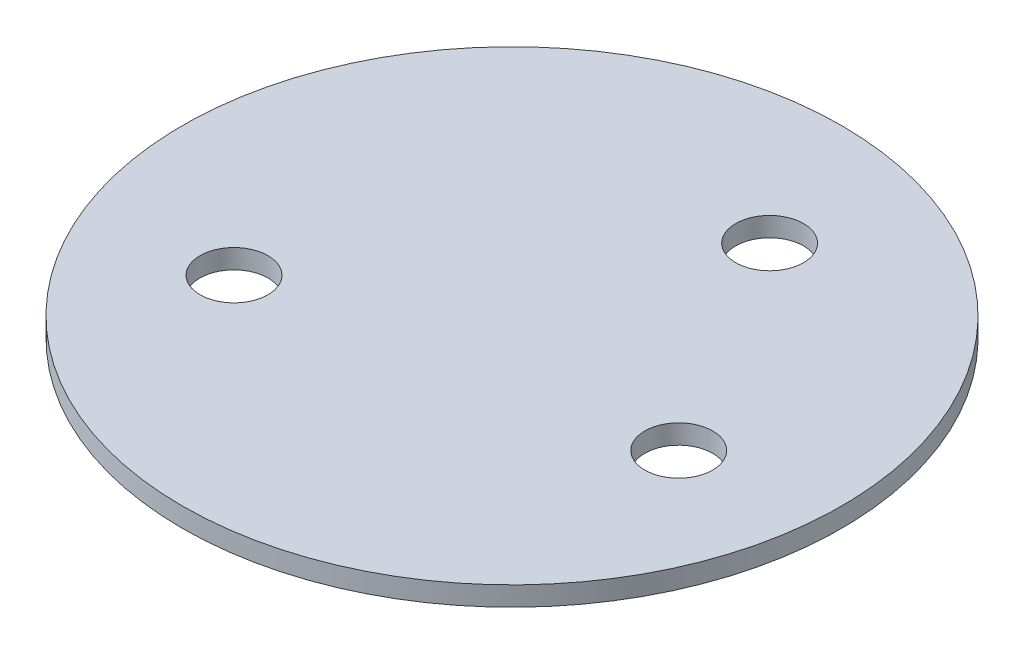
from build123d import *

# Parameters (mm, degrees)
SKETCH1_R           = 107.95
SKETCH1_R_2         = 11.1125
BOSS_EXTRUDE1_DEPTH = 6.35


with BuildPart() as part:
    # Sketch1 → Boss-Extrude1 (new body)
    with BuildSketch(Plane.XZ):
        with Locations(Location((969.445355233, -1092.230672994, 0), (0, 0, 270))):
            Circle(SKETCH1_R)
        with Locations(Location((1034.963380784, -1081.325409572, 0), (0, 0, 270))):
            Circle(SKETCH1_R_2, mode=Mode.SUBTRACT)
        with Locations(Location((991.017480219, -1155.049299737, 0), (0, 0, 270))):
            Circle(SKETCH1_R_2, mode=Mode.SUBTRACT)
        with Locations(Location((912.39295322, -1058.222440653, 0), (0, 0, 270))):
            Circle(SKETCH1_R_2, mode=Mode.SUBTRACT)
    extrude(amount=BOSS_EXTRUDE1_DEPTH)


solid = part.part
